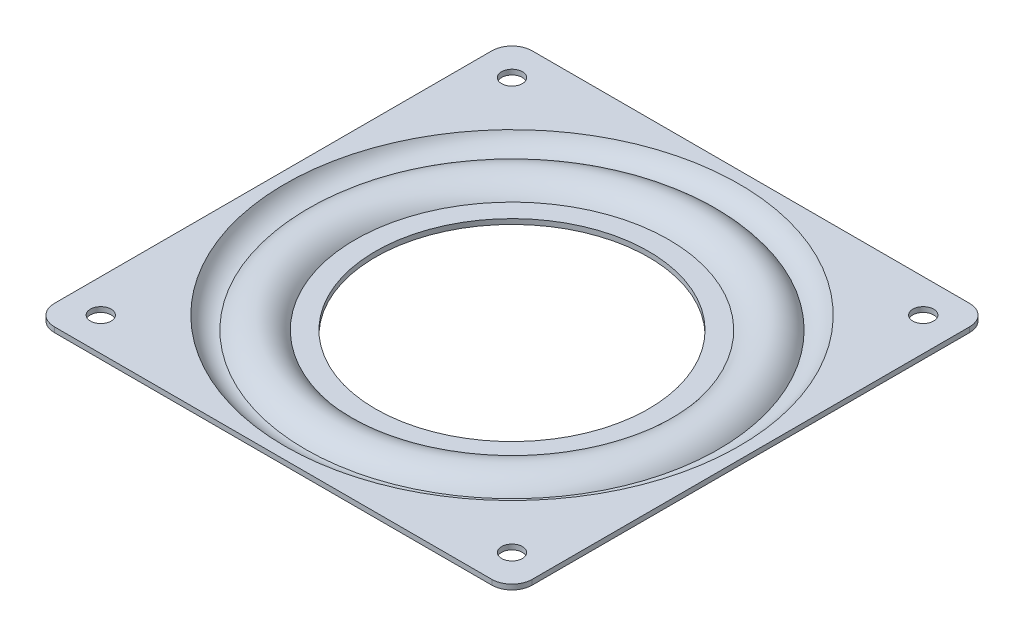
from build123d import *

# Parameters (mm, degrees)
SKETCH_2_R      = 2.05
SKETCH_2_R_2    = 44.910539349
EXTRUDE_1_DEPTH = 1


with BuildPart() as part:
    # 草图1 → 旋转1 (revolve)
    with BuildSketch(Plane.XY, mode=Mode.PRIVATE) as revolve_1_sk:
        with BuildLine():
            ThreePointArc((-45.813874016, -0.428936451), (-43.539426354, -2.86488143), (-40.275857757, -3.540203663))
            ThreePointArc((-40.275857757, -3.540203663), (-35.905809817, -1.000028754), (-31.553091654, -3.569785971))
            Line((-31.553091654, -3.569785971), (-27, -3.569785971))
            Line((-27, -3.569785971), (-27, -2.569785971))
            Line((-27, -2.569785971), (-31, -2.569785971))
            ThreePointArc((-31, -2.569785971), (-35.922766673, 0), (-40.845533346, -2.569785971))
            ThreePointArc((-40.845533346, -2.569785971), (-43.250116145, -1.873465974), (-44.910539349, 0))
            Line((-44.910539349, 0), (-45.813874016, -0.428936451))
        make_face()
    revolve(revolve_1_sk.sketch.rotate(Axis((0, 6.917160425, 0), (0, -1, 0)), 270), axis=Axis((0, 6.917160425, 0), (0, -1, 0)))

    # 草图2 → 凸台-拉伸1 (add)
    with BuildSketch(Plane(origin=(0, 0, 0), x_dir=(1, 0, 0), z_dir=(0, 1, 0))):
        with BuildLine():
            Line((43.25, 47.25), (-43.25, 47.25))
            ThreePointArc((-43.25, 47.25), (-46.078427125, 46.078427125), (-47.25, 43.25))
            Line((-47.25, 43.25), (-47.25, -43.25))
            ThreePointArc((-47.25, -43.25), (-46.078427125, -46.078427125), (-43.25, -47.25))
            Line((-43.25, -47.25), (43.25, -47.25))
            ThreePointArc((43.25, -47.25), (46.078427125, -46.078427125), (47.25, -43.25))
            Line((47.25, -43.25), (47.25, 43.25))
            ThreePointArc((47.25, 43.25), (46.078427125, 46.078427125), (43.25, 47.25))
        make_face()
        with Locations(Location((-40.658639918, -40.658639918, 0), (0, 0, 270))):
            Circle(SKETCH_2_R, mode=Mode.SUBTRACT)
        with Locations(Location((40.658639918, -40.658639918, 0), (0, 0, 270))):
            Circle(SKETCH_2_R, mode=Mode.SUBTRACT)
        with Locations(Location((-40.658639918, 40.658639918, 0), (0, 0, 270))):
            Circle(SKETCH_2_R, mode=Mode.SUBTRACT)
        Circle(SKETCH_2_R_2, mode=Mode.SUBTRACT)
        with Locations(Location((40.658639918, 40.658639918, 0), (0, 0, 270))):
            Circle(SKETCH_2_R, mode=Mode.SUBTRACT)
    extrude(amount=-EXTRUDE_1_DEPTH)


solid = part.part
